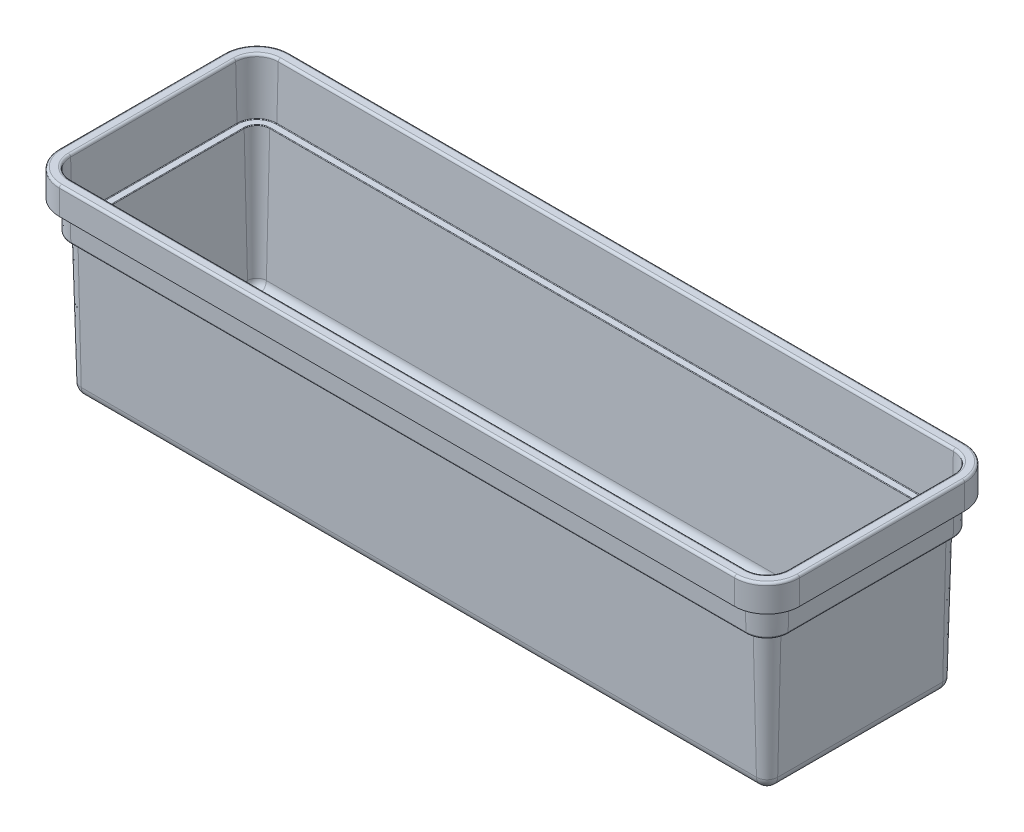
from build123d import *

# Parameters (mm, degrees)
EXTRUDE_THIN1_DEPTH  = 571.5
REVOLVE1_ANGLE       = 90
BOSS_EXTRUDE1_DEPTH  = 139.7
MIRROR2_COPY_1_ANGLE = 90
MIRROR2_COPY_2_DEPTH = 139.7
MIRROR2_COPY_3_DEPTH = 139.7


with BuildPart() as part:
    # Sketch1 → Extrude-Thin1 (new body)
    with BuildSketch(Plane(origin=(0, 0, 0), x_dir=(0, 0, -1), z_dir=(1, 0, 0))):
        with BuildLine():
            ThreePointArc((69.502647706, 0), (75.0862643, 2.27084424), (77.5, 7.794193568))
            Line((77.5, 7.794193568), (80.328682331, 117.712862902))
            ThreePointArc((80.328682331, 117.712862902), (80.479540812, 118.058072235), (80.828516849, 118.2))
            Line((80.828516849, 118.2), (85.855906535, 118.2))
            ThreePointArc((85.855906535, 118.2), (86.204882572, 118.341927765), (86.355741053, 118.687137098))
            Line((86.355741053, 118.687137098), (87.5, 163.151451608))
            ThreePointArc((87.5, 163.151451608), (88.103433925, 164.53228894), (89.499338073, 165.1))
            Line((89.499338073, 165.1), (95.025, 165.1))
            ThreePointArc((95.025, 165.1), (96.439213562, 164.514213562), (97.025, 163.1))
            Line((97.025, 163.1), (97.025, 142.3))
            Line((97.025, 142.3), (96.025, 142.3))
            Line((96.025, 142.3), (96.025, 163.1))
            ThreePointArc((96.025, 163.1), (95.732106781, 163.807106781), (95.025, 164.1))
            Line((95.025, 164.1), (89.499338073, 164.1))
            ThreePointArc((89.499338073, 164.1), (88.801385999, 163.81614447), (88.499669037, 163.125725804))
            Line((88.499669037, 163.125725804), (87.35541009, 118.661411294))
            ThreePointArc((87.35541009, 118.661411294), (86.902834646, 117.625783295), (85.855906535, 117.2))
            Line((85.855906535, 117.2), (81.315815225, 117.2))
            Line((81.315815225, 117.2), (78.499669037, 7.768467764))
            ThreePointArc((78.499669037, 7.768467764), (75.784216375, 1.55469977), (69.502647706, -1))
            Line((69.502647706, -1), (69.502647706, 0))
        make_face()
    extrude_thin1 = extrude(amount=EXTRUDE_THIN1_DEPTH)

    # Sketch4 → Revolve1 (revolve)
    with BuildSketch(Plane(origin=(571.5, 0, 0), x_dir=(0, 0, -1), z_dir=(1, 0, 0))):
        with BuildLine():
            Line((96.025, 163.1), (96.025, 142.3))
            Line((96.025, 142.3), (97.025, 142.3))
            Line((97.025, 142.3), (97.025, 163.1))
            ThreePointArc((97.025, 163.1), (96.439213562, 164.514213562), (95.025, 165.1))
            Line((95.025, 165.1), (89.499338073, 165.1))
            ThreePointArc((89.499338073, 165.1), (88.103433925, 164.53228894), (87.5, 163.151451608))
            Line((87.5, 163.151451608), (86.355741053, 118.687137098))
            ThreePointArc((86.355741053, 118.687137098), (86.204882572, 118.341927765), (85.855906535, 118.2))
            Line((85.855906535, 118.2), (80.828516849, 118.2))
            ThreePointArc((80.828516849, 118.2), (80.479540812, 118.058072235), (80.328682331, 117.712862902))
            Line((80.328682331, 117.712862902), (77.5, 7.794193568))
            ThreePointArc((77.5, 7.794193568), (75.0862643, 2.27084424), (69.502647706, 0))
            Line((69.502647706, 0), (69.502647706, -1))
            ThreePointArc((69.502647706, -1), (75.784216375, 1.55469977), (78.499669037, 7.768467764))
            Line((78.499669037, 7.768467764), (81.315815225, 117.2))
            Line((81.315815225, 117.2), (85.855906535, 117.2))
            ThreePointArc((85.855906535, 117.2), (86.902834646, 117.625783295), (87.35541009, 118.661411294))
            Line((87.35541009, 118.661411294), (88.499669037, 163.125725804))
            ThreePointArc((88.499669037, 163.125725804), (88.801385999, 163.81614447), (89.499338073, 164.1))
            Line((89.499338073, 164.1), (95.025, 164.1))
            ThreePointArc((95.025, 164.1), (95.732106781, 163.807106781), (96.025, 163.1))
        make_face()
    revolve1 = revolve(axis=Axis((571.5, -1, -69.502647706), (0, -1, 0)), revolution_arc=REVOLVE1_ANGLE)

    # Sketch5 → Boss-Extrude1 (add)
    with BuildSketch(Plane.XY.offset(-69.502647706)):
        with BuildLine():
            Line((0, 0), (0, -1))
            Line((0, -1), (571.5, -1))
            ThreePointArc((571.5, -1), (577.781568669, 1.55469977), (580.497021331, 7.768467764))
            Line((580.497021331, 7.768467764), (583.313167519, 117.2))
            Line((583.313167519, 117.2), (587.853258829, 117.2))
            ThreePointArc((587.853258829, 117.2), (588.90018694, 117.625783295), (589.352762384, 118.661411294))
            Line((589.352762384, 118.661411294), (590.497021331, 163.125725804))
            ThreePointArc((590.497021331, 163.125725804), (590.798738293, 163.81614447), (591.496690367, 164.1))
            Line((591.496690367, 164.1), (597.022352294, 164.1))
            ThreePointArc((597.022352294, 164.1), (597.729459075, 163.807106781), (598.022352294, 163.1))
            Line((598.022352294, 163.1), (598.022352294, 142.3))
            Line((598.022352294, 142.3), (599.022352294, 142.3))
            Line((599.022352294, 142.3), (599.022352294, 163.1))
            ThreePointArc((599.022352294, 163.1), (598.436565856, 164.514213562), (597.022352294, 165.1))
            Line((597.022352294, 165.1), (591.496690367, 165.1))
            ThreePointArc((591.496690367, 165.1), (590.100786219, 164.53228894), (589.497352294, 163.151451608))
            Line((589.497352294, 163.151451608), (588.353093347, 118.687137098))
            ThreePointArc((588.353093347, 118.687137098), (588.202234866, 118.341927765), (587.853258829, 118.2))
            Line((587.853258829, 118.2), (582.825869143, 118.2))
            ThreePointArc((582.825869143, 118.2), (582.476893106, 118.058072235), (582.326034625, 117.712862902))
            Line((582.326034625, 117.712862902), (579.497352294, 7.794193568))
            ThreePointArc((579.497352294, 7.794193568), (577.083616594, 2.27084424), (571.5, 0))
            Line((571.5, 0), (0, 0))
        make_face()
    boss_extrude1 = extrude(amount=BOSS_EXTRUDE1_DEPTH)

    # Mirror1: Revolve1, Boss-Extrude1 across plane
    add(revolve1.mirror(Plane(origin=(285.75, 0, 0), x_dir=(0, 0, 1), z_dir=(1, 0, 0))))
    add(boss_extrude1.mirror(Plane(origin=(285.75, 0, 0), x_dir=(0, 0, 1), z_dir=(1, 0, 0))))

    # Mirror2: Extrude-Thin1, Revolve1 across plane
    add(extrude_thin1.mirror(Plane.XY.offset(0.347352294)))
    add(revolve1.mirror(Plane.XY.offset(0.347352294)))

    # Mirror2 copy 1 sketch → Mirror2 copy 1 (revolve)
    with BuildSketch(Plane(origin=(0, 0, 0.694704588), x_dir=(0, 0, 1), z_dir=(-1, 0, 0))):
        with BuildLine():
            Line((96.025, 163.1), (96.025, 142.3))
            Line((96.025, 142.3), (97.025, 142.3))
            Line((97.025, 142.3), (97.025, 163.1))
            ThreePointArc((97.025, 163.1), (96.439213562, 164.514213562), (95.025, 165.1))
            Line((95.025, 165.1), (89.499338073, 165.1))
            ThreePointArc((89.499338073, 165.1), (88.103433925, 164.53228894), (87.5, 163.151451608))
            Line((87.5, 163.151451608), (86.355741053, 118.687137098))
            ThreePointArc((86.355741053, 118.687137098), (86.204882572, 118.341927765), (85.855906535, 118.2))
            Line((85.855906535, 118.2), (80.828516849, 118.2))
            ThreePointArc((80.828516849, 118.2), (80.479540812, 118.058072235), (80.328682331, 117.712862902))
            Line((80.328682331, 117.712862902), (77.5, 7.794193568))
            ThreePointArc((77.5, 7.794193568), (75.0862643, 2.27084424), (69.502647706, 0))
            Line((69.502647706, 0), (69.502647706, -1))
            ThreePointArc((69.502647706, -1), (75.784216375, 1.55469977), (78.499669037, 7.768467764))
            Line((78.499669037, 7.768467764), (81.315815225, 117.2))
            Line((81.315815225, 117.2), (85.855906535, 117.2))
            ThreePointArc((85.855906535, 117.2), (86.902834646, 117.625783295), (87.35541009, 118.661411294))
            Line((87.35541009, 118.661411294), (88.499669037, 163.125725804))
            ThreePointArc((88.499669037, 163.125725804), (88.801385999, 163.81614447), (89.499338073, 164.1))
            Line((89.499338073, 164.1), (95.025, 164.1))
            ThreePointArc((95.025, 164.1), (95.732106781, 163.807106781), (96.025, 163.1))
        make_face()
    revolve(axis=Axis((0, -1, 70.197352294), (0, -1, 0)), revolution_arc=MIRROR2_COPY_1_ANGLE)

    # Mirror2 copy 2 sketch → Mirror2 copy 2 (add)
    with BuildSketch(Plane(origin=(571.5, 0, 70.197352294), x_dir=(-1, 0, 0), z_dir=(0, 0, -1))):
        with BuildLine():
            Line((0, 0), (0, -1))
            Line((0, -1), (571.5, -1))
            ThreePointArc((571.5, -1), (577.781568669, 1.55469977), (580.497021331, 7.768467764))
            Line((580.497021331, 7.768467764), (583.313167519, 117.2))
            Line((583.313167519, 117.2), (587.853258829, 117.2))
            ThreePointArc((587.853258829, 117.2), (588.90018694, 117.625783295), (589.352762384, 118.661411294))
            Line((589.352762384, 118.661411294), (590.497021331, 163.125725804))
            ThreePointArc((590.497021331, 163.125725804), (590.798738293, 163.81614447), (591.496690367, 164.1))
            Line((591.496690367, 164.1), (597.022352294, 164.1))
            ThreePointArc((597.022352294, 164.1), (597.729459075, 163.807106781), (598.022352294, 163.1))
            Line((598.022352294, 163.1), (598.022352294, 142.3))
            Line((598.022352294, 142.3), (599.022352294, 142.3))
            Line((599.022352294, 142.3), (599.022352294, 163.1))
            ThreePointArc((599.022352294, 163.1), (598.436565856, 164.514213562), (597.022352294, 165.1))
            Line((597.022352294, 165.1), (591.496690367, 165.1))
            ThreePointArc((591.496690367, 165.1), (590.100786219, 164.53228894), (589.497352294, 163.151451608))
            Line((589.497352294, 163.151451608), (588.353093347, 118.687137098))
            ThreePointArc((588.353093347, 118.687137098), (588.202234866, 118.341927765), (587.853258829, 118.2))
            Line((587.853258829, 118.2), (582.825869143, 118.2))
            ThreePointArc((582.825869143, 118.2), (582.476893106, 118.058072235), (582.326034625, 117.712862902))
            Line((582.326034625, 117.712862902), (579.497352294, 7.794193568))
            ThreePointArc((579.497352294, 7.794193568), (577.083616594, 2.27084424), (571.5, 0))
            Line((571.5, 0), (0, 0))
        make_face()
    extrude(amount=MIRROR2_COPY_2_DEPTH)

    # Mirror2 copy 3 sketch → Mirror2 copy 3 (add)
    with BuildSketch(Plane(origin=(0, 0, 70.197352294), x_dir=(1, 0, 0), z_dir=(0, 0, -1))):
        with BuildLine():
            Line((0, 0), (0, 1))
            Line((0, 1), (571.5, 1))
            ThreePointArc((571.5, 1), (577.781568669, -1.55469977), (580.497021331, -7.768467764))
            Line((580.497021331, -7.768467764), (583.313167519, -117.2))
            Line((583.313167519, -117.2), (587.853258829, -117.2))
            ThreePointArc((587.853258829, -117.2), (588.90018694, -117.625783295), (589.352762384, -118.661411294))
            Line((589.352762384, -118.661411294), (590.497021331, -163.125725804))
            ThreePointArc((590.497021331, -163.125725804), (590.798738293, -163.81614447), (591.496690367, -164.1))
            Line((591.496690367, -164.1), (597.022352294, -164.1))
            ThreePointArc((597.022352294, -164.1), (597.729459075, -163.807106781), (598.022352294, -163.1))
            Line((598.022352294, -163.1), (598.022352294, -142.3))
            Line((598.022352294, -142.3), (599.022352294, -142.3))
            Line((599.022352294, -142.3), (599.022352294, -163.1))
            ThreePointArc((599.022352294, -163.1), (598.436565856, -164.514213562), (597.022352294, -165.1))
            Line((597.022352294, -165.1), (591.496690367, -165.1))
            ThreePointArc((591.496690367, -165.1), (590.100786219, -164.53228894), (589.497352294, -163.151451608))
            Line((589.497352294, -163.151451608), (588.353093347, -118.687137098))
            ThreePointArc((588.353093347, -118.687137098), (588.202234866, -118.341927765), (587.853258829, -118.2))
            Line((587.853258829, -118.2), (582.825869143, -118.2))
            ThreePointArc((582.825869143, -118.2), (582.476893106, -118.058072235), (582.326034625, -117.712862902))
            Line((582.326034625, -117.712862902), (579.497352294, -7.794193568))
            ThreePointArc((579.497352294, -7.794193568), (577.083616594, -2.27084424), (571.5, 0))
            Line((571.5, 0), (0, 0))
        make_face()
    extrude(amount=MIRROR2_COPY_3_DEPTH)


solid = part.part
